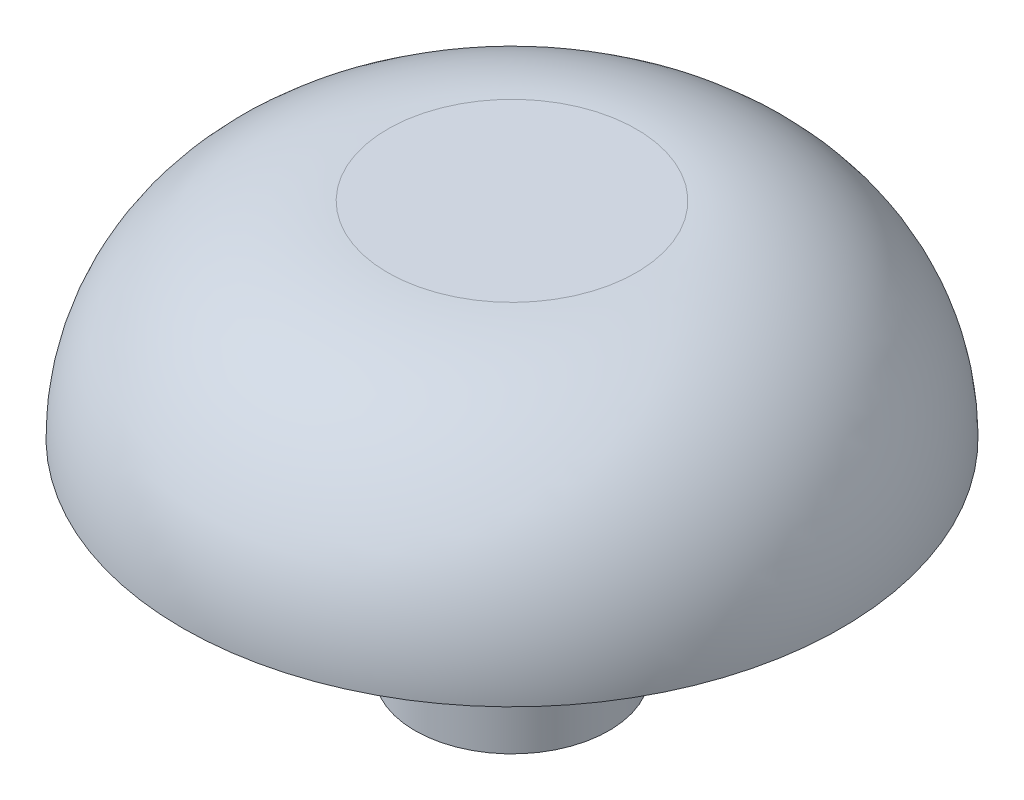
from build123d import *

# Parameters (mm, degrees)
FURO_ROSCADO_DE_M41_D           = 3.3
FURO_ROSCADO_DE_M41_DEPTH       = 11.5
FURO_ROSCADO_DE_M41_CSINK_D     = 4.05
FURO_ROSCADO_DE_M41_CSINK_ANGLE = 90
FURO_ROSCADO_DE_M41_TIP         = 0.991420021


with BuildPart() as part:
    # Esboço1 → Revolução1 (revolve)
    with BuildSketch(Plane.XY, mode=Mode.PRIVATE) as revolu_o1_sk:
        with BuildLine():
            Line((0, 0), (0, -16.5))
            Line((0, -16.5), (3.9, -16.5))
            Line((3.9, -16.5), (3.9, -2))
            Line((3.9, -2), (5, -2))
            ThreePointArc((5, -2), (9.419417382, -3.830582618), (11.25, -8.25))
            Line((11.25, -8.25), (13.25, -8.25))
            ThreePointArc((13.25, -8.25), (10.833630945, -2.416369055), (5, 0))
            Line((5, 0), (0, 0))
        make_face()
    revolve(revolu_o1_sk.sketch.rotate(Axis((0, 0, 0), (0, -1, 0)), 90), axis=Axis((0, 0, 0), (0, -1, 0)))

    # Furo roscado de M41
    with Locations(Plane(origin=(0, -16.5, 0), x_dir=(-1, 0, 0), z_dir=(0, -1, 0))):
        with Locations((0, 0)):
            CounterSinkHole(FURO_ROSCADO_DE_M41_D / 2, FURO_ROSCADO_DE_M41_CSINK_D / 2, depth=FURO_ROSCADO_DE_M41_DEPTH, counter_sink_angle=FURO_ROSCADO_DE_M41_CSINK_ANGLE)
            with Locations((0, 0, -(FURO_ROSCADO_DE_M41_DEPTH + FURO_ROSCADO_DE_M41_TIP / 2))):  # 118° drill point
                Cone(0, FURO_ROSCADO_DE_M41_D / 2, FURO_ROSCADO_DE_M41_TIP, mode=Mode.SUBTRACT)


solid = part.part
